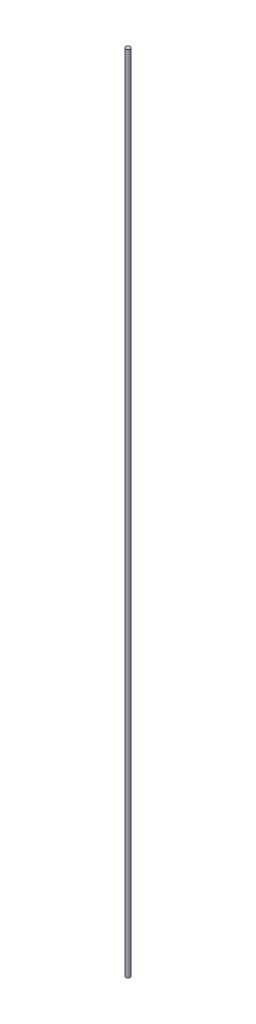
from build123d import *

# Parameters (mm, degrees)
SKETCH1_R           = 4
BOSS_EXTRUDE1_DEPTH = 1500


with BuildPart() as part:
    # Sketch1 → Boss-Extrude1 (new body)
    with BuildSketch(Plane(origin=(0, 0, 0), x_dir=(1, 0, 0), z_dir=(0, 1, 0))):
        with Locations(Location((0, 0, 0), (0, 0, 270))):
            Circle(SKETCH1_R)
    extrude(amount=BOSS_EXTRUDE1_DEPTH)


solid = part.part
